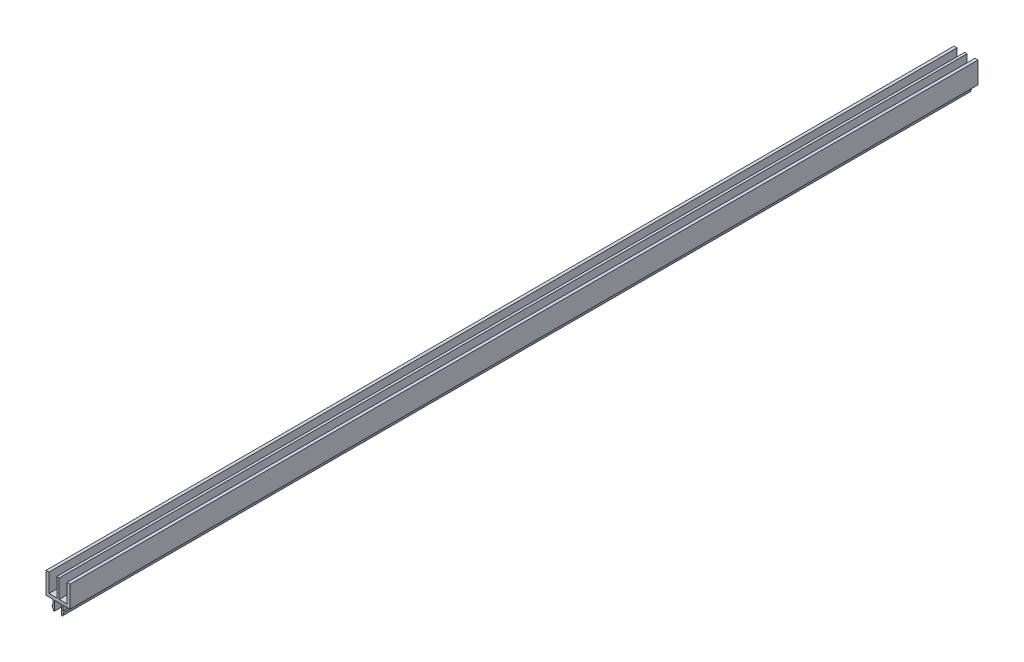
from build123d import *

# Parameters (mm, degrees)
BOSS_EXTRU_1_DEPTH = 756


with BuildPart() as part:
    # Esquisse1 → Boss.-Extru.1 (new body)
    with BuildSketch(Plane.XY.offset(50)):
        Polygon((-1, 2.5), (-7.5, 2.5), (-7.5, 17.999999998), (-10, 17.999999998), (-10, 0), (-4, 0), (-4, -4.5), (-5, -4.5), (-3.75, -8), (-3, -8), (-3, 0), (3, 0), (3, -8), (3.75, -8), (5, -4.5), (4, -4.5), (4, 0), (10, 0), (10, 17.999999998), (7.5, 17.999999998), (7.5, 2.5), (1, 2.5), (1, 17.999999998), (-1, 17.999999998), align=None)
    extrude(amount=-BOSS_EXTRU_1_DEPTH)


solid = part.part
